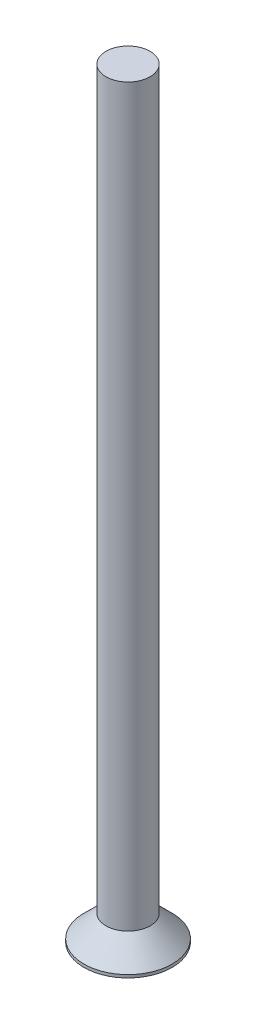
from build123d import *

# Parameters (mm, degrees)
SKETCH2_W = 1.5
SKETCH2_H = 50


with BuildPart() as part:
    # Sketch2 → Revolve1 (revolve)
    with BuildSketch(Plane.XY):
        with Locations((0.75, 26.5)):
            Rectangle(SKETCH2_W, SKETCH2_H)
        Polygon((3, -0.2), (3, 0), (1.5, 1.5), (0, 1.5), (0, -0.2), align=None)
    revolve(axis=Axis((0, 1.5, 0), (0, 1, 0)))


solid = part.part
